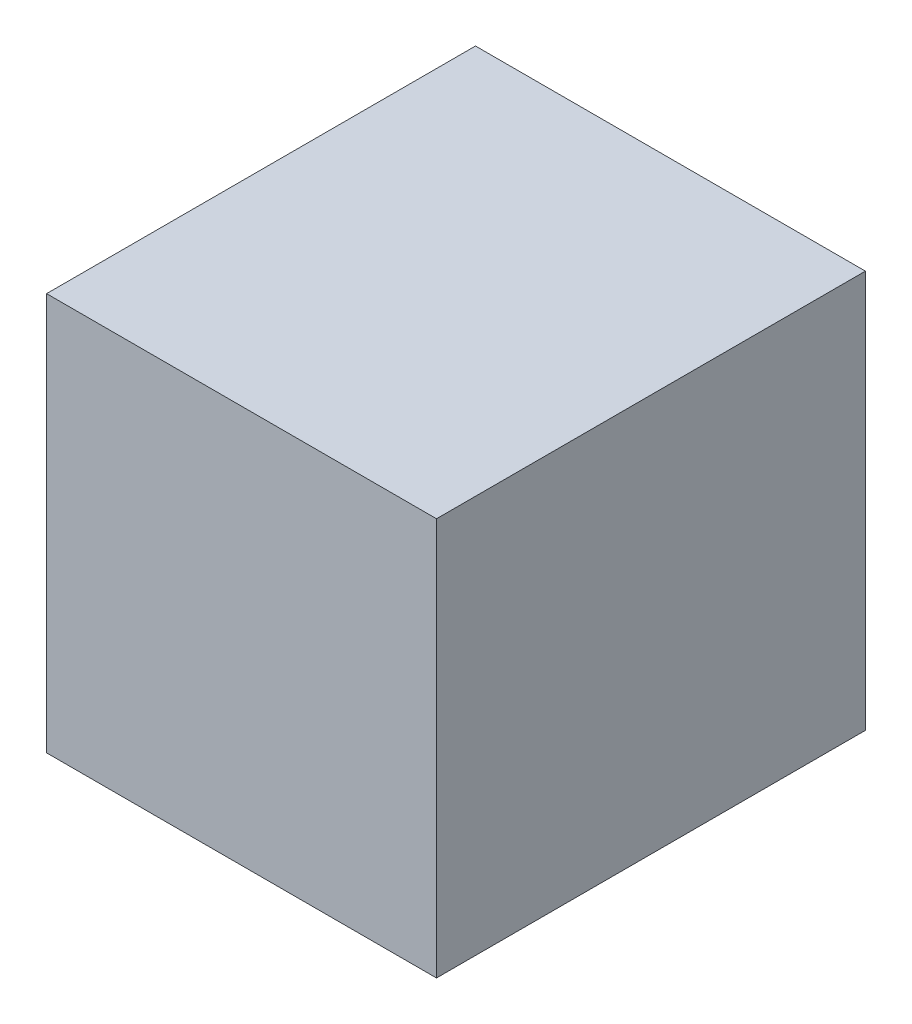
from build123d import *

# Parameters (mm, degrees)
SKETCH1_W           = 50
SKETCH1_H           = 51
BOSS_EXTRUDE2_DEPTH = 5
BOSS_EXTRUDE3_DEPTH = 5
SKETCH8_W           = 50
SKETCH8_H           = 55
BOSS_EXTRUDE4_DEPTH = 5
SKETCH13_W          = 55
SKETCH13_H          = 51
BOSS_EXTRUDE5_DEPTH = 5
SKETCH14_W          = 50
SKETCH14_H          = 55
BOSS_EXTRUDE6_DEPTH = 5


with BuildPart() as part:
    # Sketch1 → Boss-Extrude2 (new body)
    with BuildSketch(Plane.XY):
        Rectangle(SKETCH1_W, SKETCH1_H)
    extrude(amount=BOSS_EXTRUDE2_DEPTH)

    # Sketch3 → Boss-Extrude3 (add)
    with BuildSketch(Plane(origin=(25, 0, 0), x_dir=(0, 0, -1), z_dir=(1, 0, 0))):
        Polygon((-5, 25.5), (50, 25.5), (50, -25.5), (0, -25.5), (-5, -25.5), align=None)
    extrude(amount=-BOSS_EXTRUDE3_DEPTH)

    # Sketch8 → Boss-Extrude4 (add)
    with BuildSketch(Plane(origin=(0, 25.5, 0), x_dir=(1, 0, 0), z_dir=(0, 1, 0))):
        with Locations((0, 22.5)):
            Rectangle(SKETCH8_W, SKETCH8_H)
    extrude(amount=-BOSS_EXTRUDE4_DEPTH)

    # Sketch13 → Boss-Extrude5 (add)
    with BuildSketch(Plane.ZY.offset(25)):
        with Locations((-22.5, 0)):
            Rectangle(SKETCH13_W, SKETCH13_H)
    extrude(amount=-BOSS_EXTRUDE5_DEPTH)

    # Sketch14 → Boss-Extrude6 (add)
    with BuildSketch(Plane.XZ.offset(25.5)):
        with Locations((0, -22.5)):
            Rectangle(SKETCH14_W, SKETCH14_H)
    extrude(amount=-BOSS_EXTRUDE6_DEPTH)


solid = part.part
